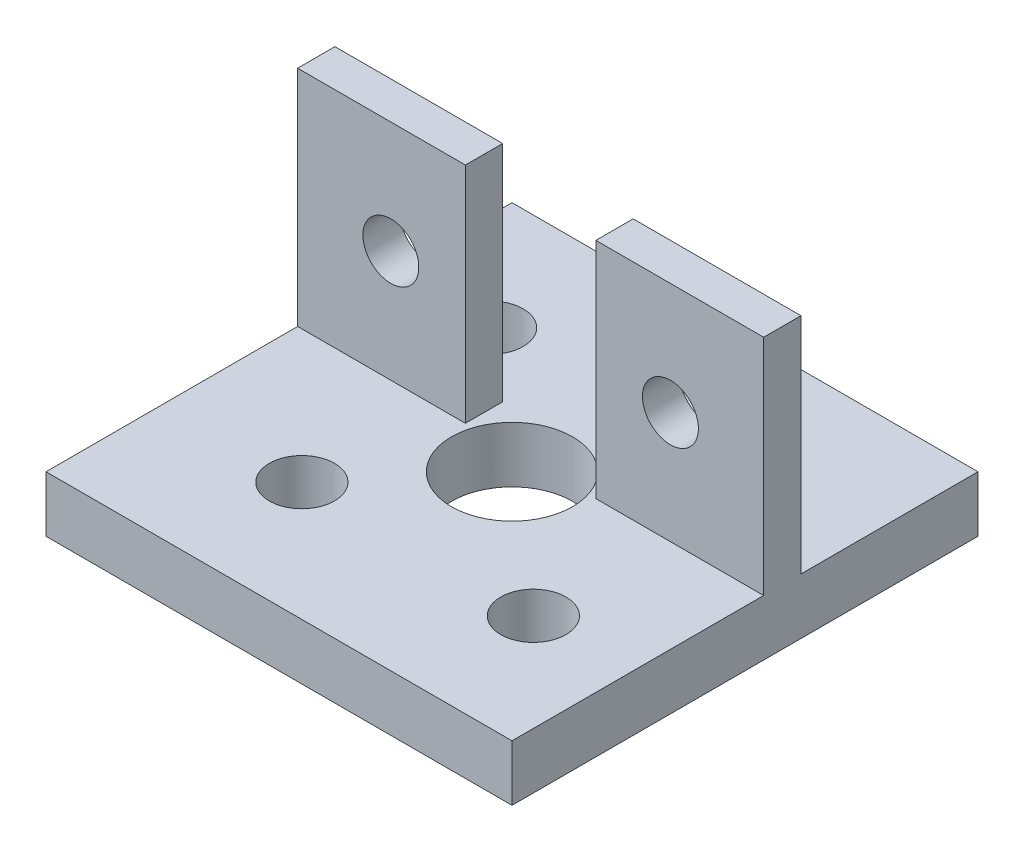
from build123d import *

# Parameters (mm, degrees)
SKETCH4_W           = 25
SKETCH4_H           = 25
BOSS_EXTRUDE2_DEPTH = 3
SKETCH1_R           = 1.75
CUT_EXTRUDE3_DEPTH  = 18.930421077
SKETCH5_W           = 9
SKETCH5_H           = 2
BOSS_EXTRUDE3_DEPTH = 12
SKETCH6_R           = 3.25
CUT_EXTRUDE4_DEPTH  = 24.184046239
SKETCH7_R           = 1.5
CUT_EXTRUDE5_DEPTH  = 2


with BuildPart() as part:
    # Sketch4 → Boss-Extrude2 (new body)
    with BuildSketch(Plane(origin=(0, 0, 0), x_dir=(1, 0, 0), z_dir=(0, 1, 0))):
        Rectangle(SKETCH4_W, SKETCH4_H)
    extrude(amount=BOSS_EXTRUDE2_DEPTH)

    # Sketch1 → Cut-Extrude3 (cut, through all)
    with BuildSketch(Plane(origin=(0, 0, 0), x_dir=(1, 0, 0), z_dir=(0, 1, 0))):
        with Locations(Location((-7.266656382, 6.119289585, 0), (0, 0, 270))):
            Circle(SKETCH1_R)
        with Locations(Location((5.153085966, 6.119289585, 0), (0, 0, 270))):
            Circle(SKETCH1_R)
        with Locations(Location((-5.153085966, -6.119289585, 0), (0, 0, 90))):
            Circle(SKETCH1_R)
        with Locations(Location((7.266656382, -6.119289585, 0), (0, 0, 90))):
            Circle(SKETCH1_R)
    extrude(amount=CUT_EXTRUDE3_DEPTH, mode=Mode.SUBTRACT)

    # Sketch5 → Boss-Extrude3 (add)
    with BuildSketch(Plane(origin=(0, 3, 0), x_dir=(1, 0, 0), z_dir=(0, 1, 0))):
        with Locations((8, 2)):
            Rectangle(SKETCH5_W, SKETCH5_H)
        with Locations((-8, 2)):
            Rectangle(SKETCH5_W, SKETCH5_H)
    extrude(amount=BOSS_EXTRUDE3_DEPTH)

    # Sketch6 → Cut-Extrude4 (cut, through all)
    with BuildSketch(Plane.XZ):
        with Locations(Location((0, 0, 0), (0, 0, 270))):
            Circle(SKETCH6_R)
    extrude(amount=-CUT_EXTRUDE4_DEPTH, mode=Mode.SUBTRACT)

    # Sketch7 → Cut-Extrude5 (cut)
    with BuildSketch(Plane(origin=(0, 0, -3), x_dir=(-1, 0, 0), z_dir=(0, 0, -1))):
        with Locations((-7.5, 9)):
            Circle(SKETCH7_R)
        with Locations((7.5, 9)):
            Circle(SKETCH7_R)
    extrude(amount=-CUT_EXTRUDE5_DEPTH, mode=Mode.SUBTRACT)


solid = part.part
